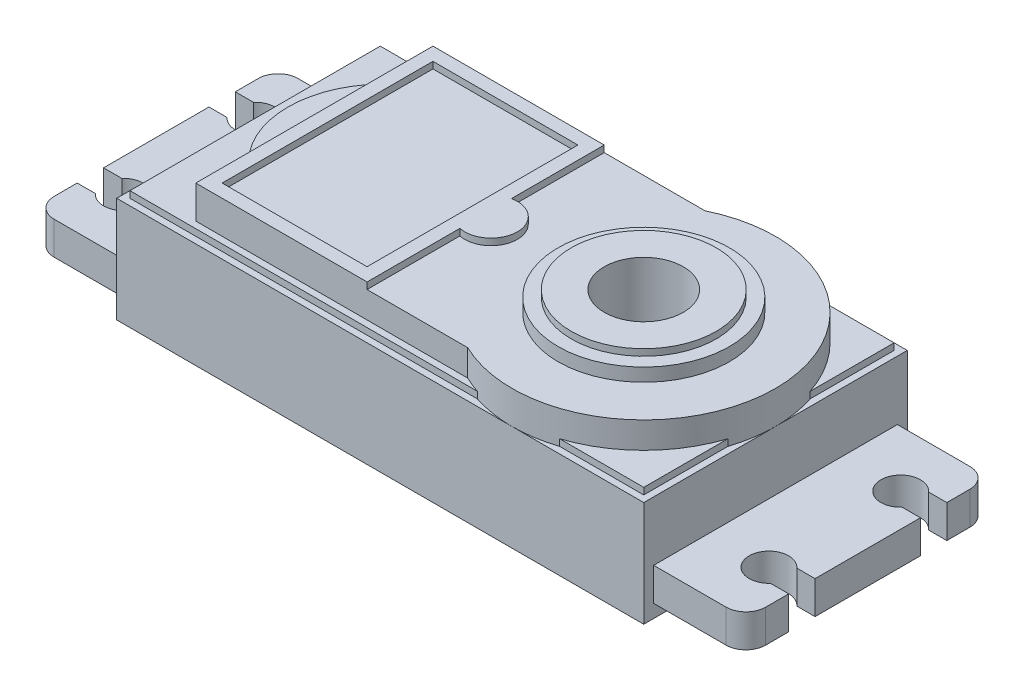
from build123d import *

# Parameters (mm, degrees)
SCHIZZO2_W                   = 40
SCHIZZO2_H                   = 20
ESTRUSIONE_ESTRUSIONE2_DEPTH = 8
TAGLIO_ESTRUSIONE4_DEPTH     = 6
ESTRUSIONE_ESTRUSIONE4_DEPTH = 2.5
SCHIZZO8_W                   = 39
SCHIZZO8_H                   = 19
ESTRUSIONE_ESTRUSIONE3_DEPTH = 0.5
SCHIZZO10_W                  = 11
SCHIZZO10_H                  = 16
ESTRUSIONE_ESTRUSIONE5_DEPTH = 0.5
SCHIZZO11_R                  = 6.5
ESTRUSIONE_ESTRUSIONE6_DEPTH = 1
SCHIZZO12_R                  = 5.5
ESTRUSIONE_ESTRUSIONE7_DEPTH = 0.5
SCHIZZO13_R                  = 3
TAGLIO_ESTRUSIONE5_DEPTH     = 26.377155081
SCHIZZO15_R                  = 1.5
ESTRUSIONE_ESTRUSIONE8_DEPTH = 2.5
SCHIZZO17_W                  = 7.322091749
SCHIZZO17_H                  = 2
TAGLIO_ESTRUSIONE6_DEPTH     = 31.020826105
SPECCHIA4_COPY_1_SKETCH_W    = 7.322091749
SPECCHIA4_COPY_1_SKETCH_H    = 2
SPECCHIA4_COPY_1_DEPTH       = 31.020826105


with BuildPart() as part:
    # Schizzo2 → Estrusione-Estrusione2 (new body)
    with BuildSketch(Plane(origin=(0, 0, 0), x_dir=(1, 0, 0), z_dir=(0, 1, 0))):
        Rectangle(SCHIZZO2_W, SCHIZZO2_H)
    extrude(amount=ESTRUSIONE_ESTRUSIONE2_DEPTH)

    # Schizzo3 → Taglio-Estrusione4 (cut)
    with BuildSketch(Plane(origin=(0, 0, 0), x_dir=(1, 0, 0), z_dir=(0, 1, 0))):
        Polygon((16, -8), (-16, -8), (-16, -6), (-18, -6), (-18, 6), (-16, 6), (-16, 8), (16, 8), (16, 6), (18, 6), (18, -6), (16, -6), align=None)
    extrude(amount=TAGLIO_ESTRUSIONE4_DEPTH, mode=Mode.SUBTRACT)

    # Schizzo4 → Foro per Vite M1-1 (revolve, cut)
    with BuildSketch(Plane(origin=(-18, 0, 8), x_dir=(0, 0, -1), z_dir=(1, 0, 0))):
        Polygon((0, 0), (0, 5.390559402), (0.65, 5), (0.65, 0.025), (0.675, 0), align=None)
    foro_per_vite_m1_1 = revolve(axis=Axis((-18, -6.35, 8), (0, 1, 0)), mode=Mode.SUBTRACT)

    # Specchia1: Foro per Vite M1-1 across plane
    add(foro_per_vite_m1_1.mirror(Plane(origin=(0, 0, 0), x_dir=(0, 0, 1), z_dir=(1, 0, 0))), mode=Mode.SUBTRACT)

    # Specchia2: Foro per Vite M1-1 across plane
    add(foro_per_vite_m1_1.mirror(Plane.XY), mode=Mode.SUBTRACT)

    # Specchia2 copy 1 sketch → Specchia2 copy 1 (revolve, cut)
    with BuildSketch(Plane(origin=(18, 0, -8), x_dir=(0, 0, 1), z_dir=(-1, 0, 0))):
        Polygon((0, 0), (0, 5.390559402), (0.65, 5), (0.65, 0.025), (0.675, 0), align=None)
    revolve(axis=Axis((18, -6.35, -8), (0, 1, 0)), mode=Mode.SUBTRACT)

    # Taglia-Sweep3: sweep along a path in Schizzo5
    with BuildLine(Plane.XZ) as taglia_sweep3_path:
        Line((19, -9), (-19, -9))
        Line((-19, -9), (-19, 9))
        Line((-19, 9), (19, 9))
        Line((19, 9), (19, -9))
    # Schizzo7 → Taglia-Sweep3 (sweep, cut)
    with BuildSketch(Plane.XY):
        with BuildLine():
            Line((-19.25, 0), (-18.75, 0))
            ThreePointArc((-18.75, 0), (-19, 0.25), (-19.25, 0))
        make_face()
    sweep(path=taglia_sweep3_path.line, transition=Transition.RIGHT, mode=Mode.SUBTRACT)

    # Schizzo9 → Estrusione-Estrusione4 (add)
    with BuildSketch(Plane(origin=(0, 8, 0), x_dir=(1, 0, 0), z_dir=(0, 1, 0))):
        with BuildLine():
            Line((5.641101056, 9), (-15, 9))
            Line((-15, 9), (-15, 5))
            ThreePointArc((-15, 5), (-17, 0), (-15, -5))
            Line((-15, -5), (-15, -9))
            Line((-15, -9), (5.641101056, -9))
            ThreePointArc((5.641101056, -9), (20, 0), (5.641101056, 9))
        make_face()
    extrude(amount=ESTRUSIONE_ESTRUSIONE4_DEPTH)

    # Schizzo8 → Estrusione-Estrusione3 (add)
    with BuildSketch(Plane(origin=(0, 8, 0), x_dir=(1, 0, 0), z_dir=(0, 1, 0))):
        Rectangle(SCHIZZO8_W, SCHIZZO8_H)
    extrude(amount=ESTRUSIONE_ESTRUSIONE3_DEPTH)

    # Schizzo10 → Estrusione-Estrusione5 (add)
    with BuildSketch(Plane(origin=(0, 10.5, 0), x_dir=(1, 0, 0), z_dir=(0, 1, 0))):
        with BuildLine():
            Line((-15, 9), (-2, 9))
            Line((-2, 9), (-2, 1.957707578))
            ThreePointArc((-2, 1.957707578), (0.409122281, 0), (-2, -1.957707578))
            Line((-2, -1.957707578), (-2, -9))
            Line((-2, -9), (-15, -9))
            Line((-15, -9), (-15, 9))
        make_face()
        with Locations((-8.5, 0)):
            Rectangle(SCHIZZO10_W, SCHIZZO10_H, mode=Mode.SUBTRACT)
    extrude(amount=ESTRUSIONE_ESTRUSIONE5_DEPTH)

    # Schizzo11 → Estrusione-Estrusione6 (add)
    with BuildSketch(Plane(origin=(0, 10.5, 0), x_dir=(1, 0, 0), z_dir=(0, 1, 0))):
        with Locations(Location((10, 0, 0), (0, 0, 270))):
            Circle(SCHIZZO11_R)
    extrude(amount=ESTRUSIONE_ESTRUSIONE6_DEPTH)

    # Schizzo12 → Estrusione-Estrusione7 (add)
    with BuildSketch(Plane(origin=(0, 11.5, 0), x_dir=(1, 0, 0), z_dir=(0, 1, 0))):
        with Locations(Location((10, 0, 0), (0, 0, 270))):
            Circle(SCHIZZO12_R)
    extrude(amount=ESTRUSIONE_ESTRUSIONE7_DEPTH)

    # Schizzo13 → Taglio-Estrusione5 (cut, through all)
    with BuildSketch(Plane(origin=(0, 12, 0), x_dir=(1, 0, 0), z_dir=(0, 1, 0))):
        with Locations(Location((10, 0, 0), (0, 0, 270))):
            Circle(SCHIZZO13_R)
    extrude(amount=-TAGLIO_ESTRUSIONE5_DEPTH, mode=Mode.SUBTRACT)

    # Schizzo15 → Estrusione-Estrusione8 (add)
    with BuildSketch(Plane(origin=(0, 1, 0), x_dir=(-1, 0, 0), z_dir=(0, -1, 0))):
        with BuildLine():
            Line((-25.5, 9.25), (-20, 9.25))
            Line((-20, 9.25), (-20, -9.25))
            Line((-20, -9.25), (-25.5, -9.25))
            ThreePointArc((-25.5, -9.25), (-26.560660172, -8.810660172), (-27, -7.75))
            Line((-27, -7.75), (-27, 7.75))
            ThreePointArc((-27, 7.75), (-26.560660172, 8.810660172), (-25.5, 9.25))
        make_face()
        with Locations(Location((-24.5, 5, 0), (0, 0, 90))):
            Circle(SCHIZZO15_R, mode=Mode.SUBTRACT)
        with Locations(Location((-24.5, -5, 0), (0, 0, 90))):
            Circle(SCHIZZO15_R, mode=Mode.SUBTRACT)
    estrusione_estrusione8 = extrude(amount=-ESTRUSIONE_ESTRUSIONE8_DEPTH)

    # Schizzo17 → Taglio-Estrusione6 (cut, through all)
    with BuildSketch(Plane(origin=(0, 3.5, 0), x_dir=(1, 0, 0), z_dir=(0, 1, 0))):
        with Locations((30.661045875, 5)):
            Rectangle(SCHIZZO17_W, SCHIZZO17_H)
        with BuildLine():
            Line((25.618033989, 4), (27, 4))
            Line((27, 4), (27, 6))
            Line((27, 6), (25.618033989, 6))
            ThreePointArc((25.618033989, 6), (25.645827846, 5.968028175), (25.672707741, 5.93528421))
            ThreePointArc((25.672707741, 5.93528421), (25.915814538, 5.495448478), (26, 5))
            ThreePointArc((26, 5), (25.915814538, 4.504551522), (25.672707741, 4.06471579))
            ThreePointArc((25.672707741, 4.06471579), (25.645827846, 4.031971825), (25.618033989, 4))
        make_face()
    taglio_estrusione6 = extrude(amount=-TAGLIO_ESTRUSIONE6_DEPTH, mode=Mode.SUBTRACT)

    # Specchia3: Taglio-Estrusione6 across plane
    add(taglio_estrusione6.mirror(Plane.XY), mode=Mode.SUBTRACT)

    # Specchia4: Estrusione-Estrusione8, Taglio-Estrusione6 across plane
    add(estrusione_estrusione8.mirror(Plane(origin=(0, 0, 0), x_dir=(0, 0, 1), z_dir=(1, 0, 0))))
    add(taglio_estrusione6.mirror(Plane(origin=(0, 0, 0), x_dir=(0, 0, 1), z_dir=(1, 0, 0))), mode=Mode.SUBTRACT)

    # Specchia4 copy 1 sketch → Specchia4 copy 1 (cut, through all)
    with BuildSketch(Plane(origin=(0, 3.5, 0), x_dir=(-1, 0, 0), z_dir=(0, 1, 0))):
        with Locations((30.661045875, 5)):
            Rectangle(SPECCHIA4_COPY_1_SKETCH_W, SPECCHIA4_COPY_1_SKETCH_H)
        with BuildLine():
            Line((25.618033989, 4), (27, 4))
            Line((27, 4), (27, 6))
            Line((27, 6), (25.618033989, 6))
            ThreePointArc((25.618033989, 6), (25.645827846, 5.968028175), (25.672707741, 5.93528421))
            ThreePointArc((25.672707741, 5.93528421), (25.915814538, 5.495448478), (26, 5))
            ThreePointArc((26, 5), (25.915814538, 4.504551522), (25.672707741, 4.06471579))
            ThreePointArc((25.672707741, 4.06471579), (25.645827846, 4.031971825), (25.618033989, 4))
        make_face()
    extrude(amount=-SPECCHIA4_COPY_1_DEPTH, mode=Mode.SUBTRACT)


solid = part.part
